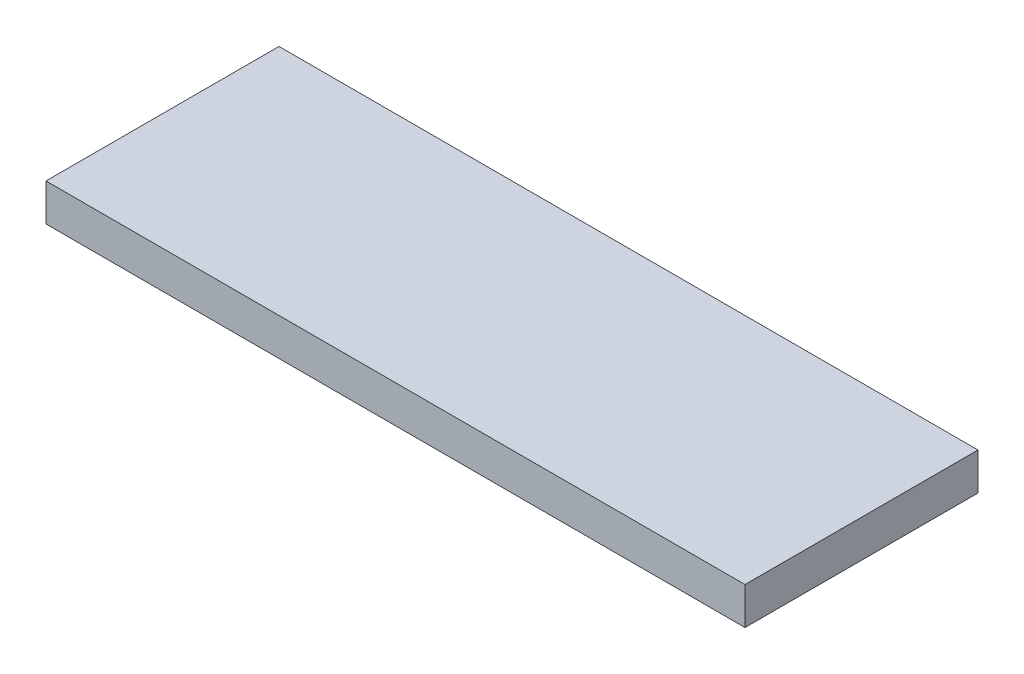
from build123d import *

# Parameters (mm, degrees)
CROQUIS1_W              = 150
CROQUIS1_H              = 50
SALIENTE_EXTRUIR1_DEPTH = 8


with BuildPart() as part:
    # Croquis1 → Saliente-Extruir1 (new body)
    with BuildSketch(Plane(origin=(0, 0, 0), x_dir=(1, 0, 0), z_dir=(0, 1, 0))):
        Rectangle(CROQUIS1_W, CROQUIS1_H)
    extrude(amount=SALIENTE_EXTRUIR1_DEPTH)


solid = part.part
